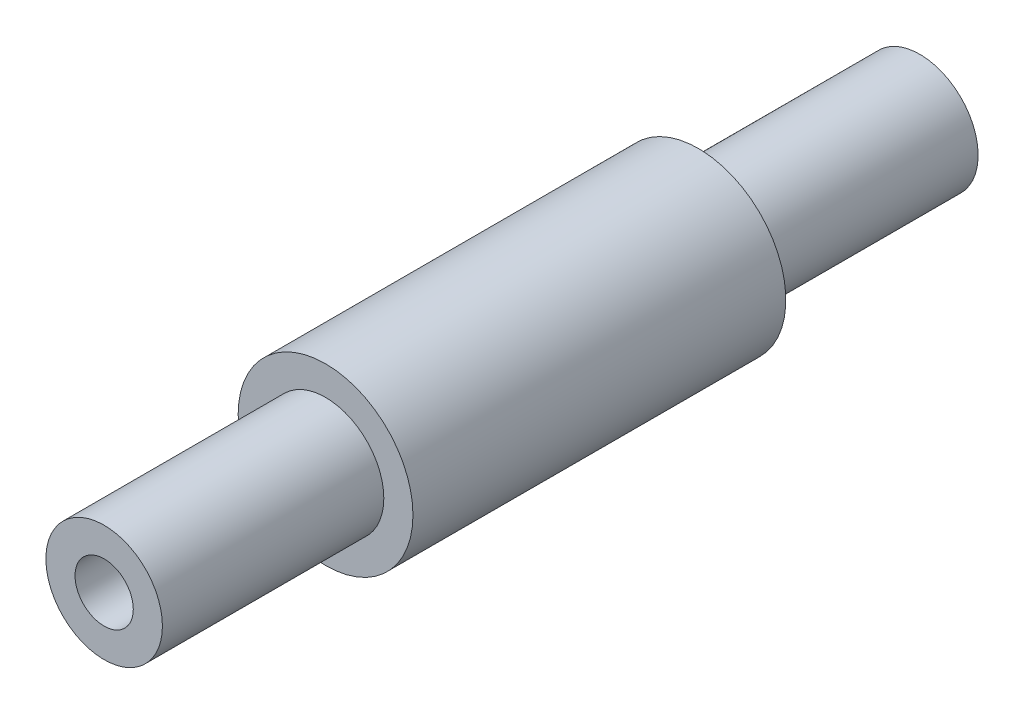
from build123d import *

# Parameters (mm, degrees)
SKETCH1_R           = 7.5
BOSS_EXTRUDE1_DEPTH = 70
SKETCH2_R           = 10.194447781
SKETCH2_R_2         = 5
CUT_EXTRUDE1_DEPTH  = 19
CUT_EXTRUDE2_START  = -19
SKETCH3_R           = 9.951910859
SKETCH3_R_2         = 5
CUT_EXTRUDE2_DEPTH  = 19
SKETCH4_R           = 2.5
CUT_EXTRUDE3_DEPTH  = 10
CUT_EXTRUDE4_START  = -10
SKETCH5_R           = 2.5
CUT_EXTRUDE4_DEPTH  = 10


with BuildPart() as part:
    # Sketch1 → Boss-Extrude1 (new body)
    with BuildSketch(Plane.XY):
        Circle(SKETCH1_R)
    extrude(amount=BOSS_EXTRUDE1_DEPTH)

    # Sketch2 → Cut-Extrude1 (cut)
    with BuildSketch(Plane(origin=(0, 0, 0), x_dir=(-1, 0, 0), z_dir=(0, 0, -1))):
        Circle(SKETCH2_R)
        Circle(SKETCH2_R_2, mode=Mode.SUBTRACT)
    extrude(amount=-CUT_EXTRUDE1_DEPTH, mode=Mode.SUBTRACT)

    # Sketch3 → Cut-Extrude2 (cut)
    with BuildSketch(Plane.XY.offset(70).offset(CUT_EXTRUDE2_START)):
        Circle(SKETCH3_R)
        with Locations(Location((0, 0, 0), (0, 0, 180))):
            Circle(SKETCH3_R_2, mode=Mode.SUBTRACT)
    extrude(amount=CUT_EXTRUDE2_DEPTH, mode=Mode.SUBTRACT)

    # Sketch4 → Cut-Extrude3 (cut)
    with BuildSketch(Plane.XY.offset(70)):
        Circle(SKETCH4_R)
    extrude(amount=-CUT_EXTRUDE3_DEPTH, mode=Mode.SUBTRACT)

    # Sketch5 → Cut-Extrude4 (cut)
    with BuildSketch(Plane(origin=(0, 0, 0), x_dir=(-1, 0, 0), z_dir=(0, 0, -1)).offset(CUT_EXTRUDE4_START)):
        with Locations(Location((0, 0, 0), (0, 0, 180))):
            Circle(SKETCH5_R)
    extrude(amount=CUT_EXTRUDE4_DEPTH, mode=Mode.SUBTRACT)


solid = part.part
